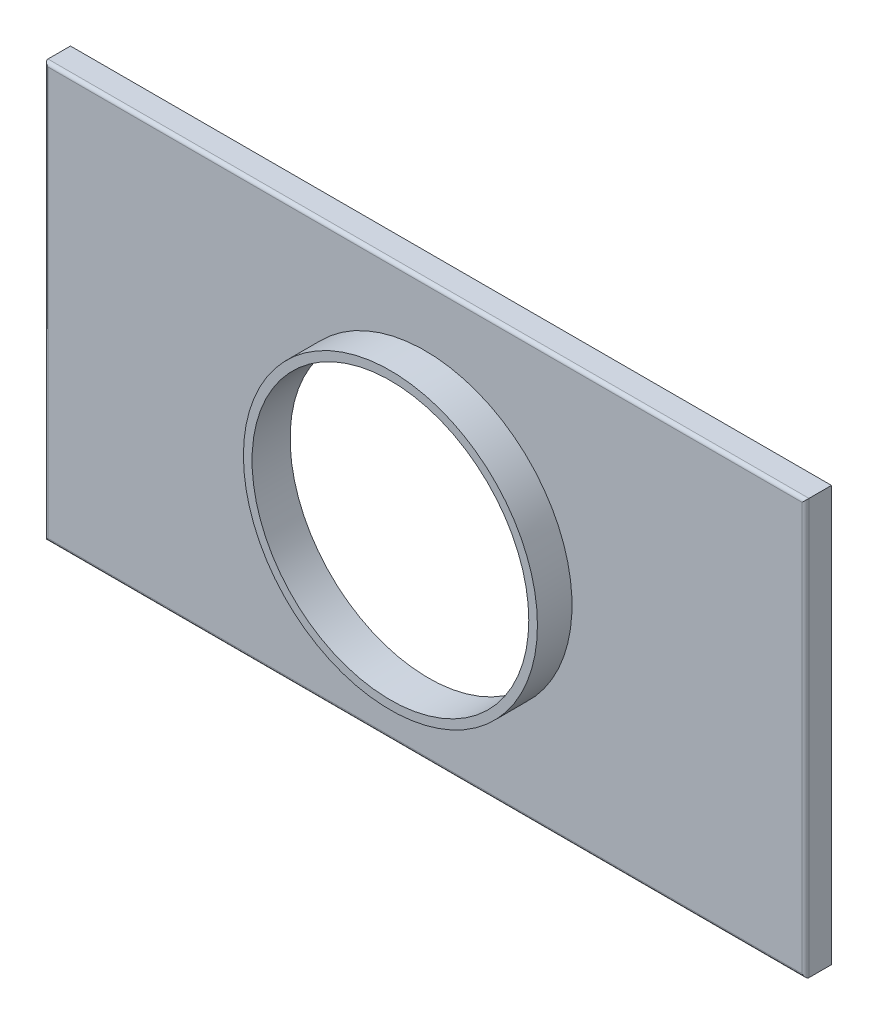
from build123d import *

# Parameters (mm, degrees)
SKETCH1_W           = 558.8
SKETCH1_H           = 304.8
BOSS_EXTRUDE1_DEPTH = 2.54
SKETCH2_W           = 558.8
SKETCH2_H           = 304.8
SKETCH2_W_2         = 553.72
SKETCH2_H_2         = 299.72
BOSS_EXTRUDE2_DEPTH = 19.05
FILLET1_R           = 2.54
SKETCH4_R           = 101.6
CUT_EXTRUDE2_DEPTH  = 19.05
BOSS_EXTRUDE3_START = 25.4
SKETCH5_R           = 107.95
SKETCH5_R_2         = 101.6
BOSS_EXTRUDE3_DEPTH = 25.4


with BuildPart() as part:
    # Sketch1 → Boss-Extrude1 (new body)
    with BuildSketch(Plane.XY):
        Rectangle(SKETCH1_W, SKETCH1_H)
    extrude(amount=BOSS_EXTRUDE1_DEPTH)

    # Sketch2 → Boss-Extrude2 (add)
    with BuildSketch(Plane.XY.offset(2.54)):
        Rectangle(SKETCH2_W, SKETCH2_H)
        Rectangle(SKETCH2_W_2, SKETCH2_H_2, mode=Mode.SUBTRACT)
    extrude(amount=-BOSS_EXTRUDE2_DEPTH)

    # Fillet1
    fillet1_edges = [part.edges().sort_by_distance(p)[0] for p in [
        (-279.4, 0, 2.54),
        (0, -152.4, 2.54),
        (279.4, 0, 2.54),
        (0, 152.4, 2.54),
    ]]
    fillet(fillet1_edges, radius=FILLET1_R)

    # Sketch4 → Cut-Extrude2 (cut)
    with BuildSketch(Plane.XY.offset(2.54)):
        Circle(SKETCH4_R)
    extrude(amount=-CUT_EXTRUDE2_DEPTH, mode=Mode.SUBTRACT)

    # Sketch5 → Boss-Extrude3 (add)
    with BuildSketch(Plane.XY.offset(2.54).offset(BOSS_EXTRUDE3_START)):
        with Locations(Location((0, 0, 0), (0, 0, 180))):
            Circle(SKETCH5_R)
        Circle(SKETCH5_R_2, mode=Mode.SUBTRACT)
    extrude(amount=-BOSS_EXTRUDE3_DEPTH)


solid = part.part
